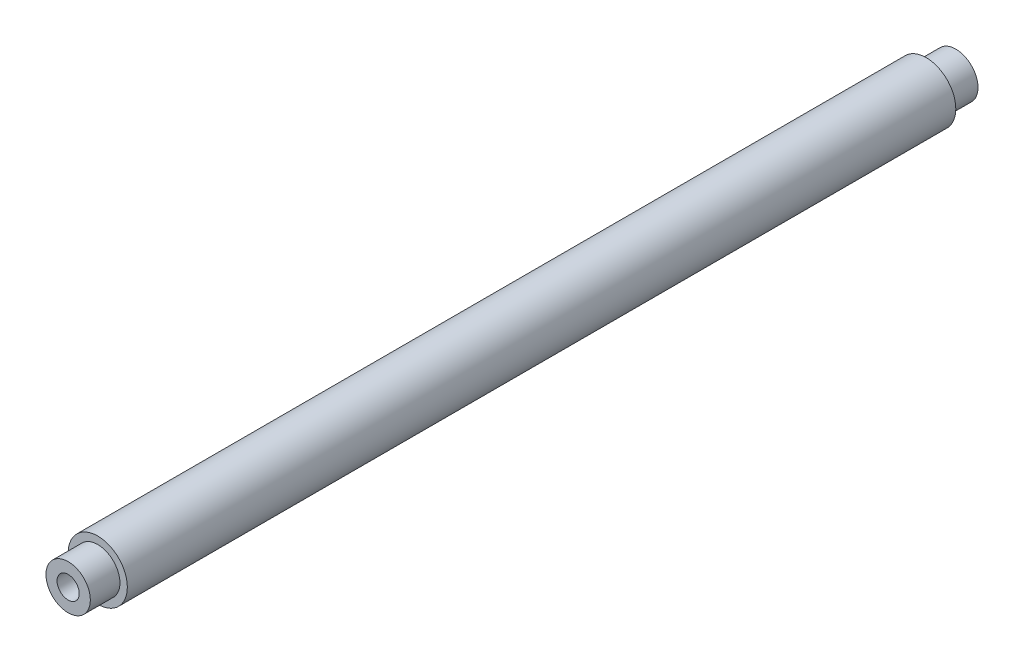
from build123d import *

# Parameters (mm, degrees)
ESQUISSE1_R             = 4
BASE_EXTRUSION_DEPTH    = 120
ESQUISSE2_R             = 4
ESQUISSE2_R_2           = 3
ENL_V_MAT_EXTRU_1_DEPTH = 4
ENL_V_START             = -4
ESQUISSE3_R             = 4
ESQUISSE3_R_2           = 3
ENL_V_MAT_EXTRU_2_DEPTH = 4
PER_AGE1_D              = 2.5
PER_AGE1_DEPTH          = 11
PER_AGE1_CBORE_D        = 3
PER_AGE1_CBORE_DEPTH    = 8
PER_AGE1_TIP            = 0.751075774
PER_AGE2_D              = 2.5
PER_AGE2_DEPTH          = 11
PER_AGE2_CBORE_D        = 3
PER_AGE2_CBORE_DEPTH    = 8
PER_AGE2_TIP            = 0.751075774


with BuildPart() as part:
    # Esquisse1 → Base-Extrusion (new body)
    with BuildSketch(Plane.XY):
        Circle(ESQUISSE1_R)
    extrude(amount=BASE_EXTRUSION_DEPTH)

    # Esquisse2 → Enlèv. mat.-Extru.1 (cut)
    with BuildSketch(Plane.XY):
        Circle(ESQUISSE2_R)
        Circle(ESQUISSE2_R_2, mode=Mode.SUBTRACT)
    extrude(amount=ENL_V_MAT_EXTRU_1_DEPTH, mode=Mode.SUBTRACT)

    # Esquisse3 → Enlèv. mat.-Extru.2 (cut)
    with BuildSketch(Plane.XY.offset(120).offset(ENL_V_START)):
        Circle(ESQUISSE3_R)
        Circle(ESQUISSE3_R_2, mode=Mode.SUBTRACT)
    extrude(amount=ENL_V_MAT_EXTRU_2_DEPTH, mode=Mode.SUBTRACT)

    # Perçage1
    with Locations(Plane.XY.offset(120)):
        with Locations((0, 0)):
            CounterBoreHole(PER_AGE1_D / 2, PER_AGE1_CBORE_D / 2, PER_AGE1_CBORE_DEPTH, depth=PER_AGE1_DEPTH)
            with Locations((0, 0, -(PER_AGE1_DEPTH + PER_AGE1_TIP / 2))):  # 118° drill point
                Cone(0, PER_AGE1_D / 2, PER_AGE1_TIP, mode=Mode.SUBTRACT)

    # Perçage2
    with Locations(Plane(origin=(0, 0, 0), x_dir=(-1, 0, 0), z_dir=(0, 0, -1))):
        with Locations((0, 0)):
            CounterBoreHole(PER_AGE2_D / 2, PER_AGE2_CBORE_D / 2, PER_AGE2_CBORE_DEPTH, depth=PER_AGE2_DEPTH)
            with Locations((0, 0, -(PER_AGE2_DEPTH + PER_AGE2_TIP / 2))):  # 118° drill point
                Cone(0, PER_AGE2_D / 2, PER_AGE2_TIP, mode=Mode.SUBTRACT)


solid = part.part
